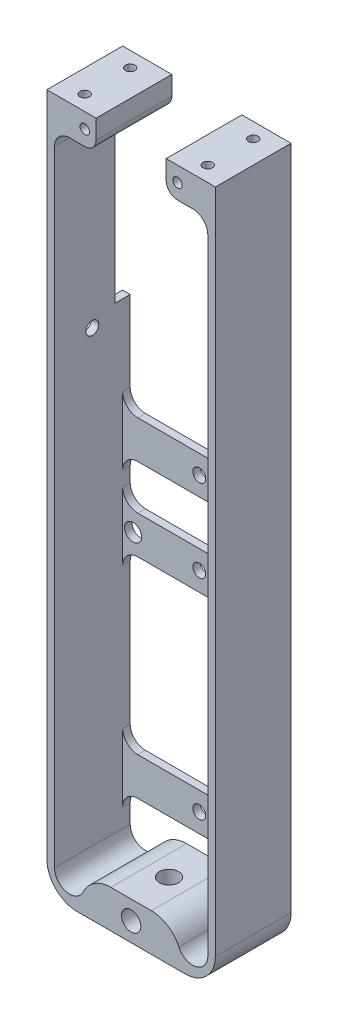
from build123d import *

# Parameters (mm, degrees)
SKETCH_1_W                = 44.5
SKETCH_1_H                = 182
EXTRUDE_1_DEPTH           = 20
FILLET_1_R                = 8
HOLE_WIZARD_1_4_201_D     = 5.1054
HOLE_WIZARD_1_4_201_DEPTH = 10
EXTRUDE_2_DEPTH           = 20
FILLET_2_R                = 100
CUT_EXTRUDE_1_REACH       = 183.194
CUT_EXTRUDE_2_REACH       = 183.636
SKETCH_7_R                = 5.25
EXTRUDE_3_DEPTH           = 20
FILLET_7_R                = 4
SKETCH_10_W               = 2
SKETCH_10_H               = 14.136672327
EXTRUDE_4_DEPTH           = 20
CUT_EXTRUDE_3_REACH       = 183.636
SKETCH_11_R               = 4.1
CUT_EXTRUDE_START         = -20
SKETCH_12_W               = 51.6
SKETCH_12_H               = 5.672918443
CUT_EXTRUDE_4_DEPTH       = 20
EXTRUDE_5_DEPTH           = 20
SKETCH_14_W               = 9.175537657
SKETCH_14_H               = 83.087631714
CUT_EXTRUDE_5_DEPTH       = 182.8267939
SKETCH_15_W               = 5
SKETCH_15_H               = 5
EXTRUDE_6_DEPTH           = 20
FILLET_10_R               = 4
HOLE_WIZARD_M31_D         = 3.4
HOLE_WIZARD_M31_DEPTH     = 2
SKETCH_21_W               = 2
SKETCH_21_H               = 34.801878649
EXTRUDE_7_DEPTH           = 20
SKETCH_23_W               = 44.5
SKETCH_23_H               = 8.742230238
CUT_EXTRUDE_8_DEPTH       = 182.8267939
SKETCH_30_W               = 2
SKETCH_30_H               = 10.09
EXTRUDE_9_DEPTH           = 20
CUT_EXTRUDE_9_REACH       = 185.604
SKETCH_32_W               = 5
SKETCH_32_H               = 3
EXTRUDE_10_DEPTH          = 20
FILLET_18_R               = 4
SKETCH_33_W               = 40.5
SKETCH_33_H               = 10
EXTRUDE_11_DEPTH          = 2
FILLET_19_R               = 4
HOLE_WIZARD_M33_D         = 3.4
HOLE_WIZARD_M33_DEPTH     = 2
HOLE_WIZARD_M33_TIP       = 1.021463052
SKETCH_36_W               = 42.5
SKETCH_36_H               = 19
CUT_EXTRUDE_11_DEPTH      = 20
SKETCH_37_W               = 11
SKETCH_37_H               = 8
EXTRUDE_12_DEPTH          = 20
FILLET_21_R               = 4
FILLET_22_R               = 3
HOLE_WIZARD_1_4_202_D     = 5.1054
HOLE_WIZARD_1_4_202_DEPTH = 6
HOLE_WIZARD_1_4_202_TIP   = 1.533816902
M3X0_52_D                 = 2.5
SKETCH_51_W               = 4.072379094
SKETCH_51_H               = 46.357723245
CUT_EXTRUDE_13_DEPTH      = 4
M3X0_53_D                 = 2.5
M3X0_53_DEPTH             = 8.5
M3X0_53_TIP               = 0.751075774
CUT_EXTRUDE_14_REACH      = 185.129
SKETCH_54_R               = 2.25
M3X0_54_D                 = 2.5
M3X0_54_DEPTH             = 8.5
M3X0_54_TIP               = 0.751075774


with BuildPart() as part:
    # Эскиз1 → Бобышка-Вытянуть1 (new body)
    with BuildSketch(Plane.XY):
        with Locations((20.25, 84)):
            Rectangle(SKETCH_1_W, SKETCH_1_H)
        with BuildLine():
            Line((8, 3), (32.5, 3))
            Line((32.5, 3), (32.5, 0))
            ThreePointArc((32.5, 0), (36.5, -4), (40.5, 0))
            Line((40.5, 0), (40.5, 173))
            Line((40.5, 173), (0, 173))
            Line((0, 173), (0, 0))
            ThreePointArc((0, 0), (4, -4), (8, 0))
            Line((8, 0), (8, 3))
        make_face(mode=Mode.SUBTRACT)
    extrude(amount=EXTRUDE_1_DEPTH)

    # Скругление1
    fillet_1_edges = [part.edges().sort_by_distance(p)[0] for p in [
        (42.5, -7, 10),
        (-2, -7, 10),
        (32.5, 3, 10),
        (8, 3, 10),
    ]]
    fillet(fillet_1_edges, radius=FILLET_1_R)

    # Отверстие обработанное метчиком 1/4-201
    with Locations(Plane(origin=(0, -7, 0), x_dir=(-1, 0, 0), z_dir=(0, -1, 0))):
        with Locations((-20.25, -10)):
            Hole(HOLE_WIZARD_1_4_201_D / 2, depth=HOLE_WIZARD_1_4_201_DEPTH)

    # Эскиз5 → Бобышка-Вытянуть2 (add)
    with BuildSketch(Plane.XY.offset(20)):
        with BuildLine():
            Line((-7.1, 158), (-7.1, 139))
            ThreePointArc((-7.1, 139), (-5.807601094, 127.936546651), (-2, 117.468859761))
            Line((-2, 117.468859761), (-2, 113.317515696))
            ThreePointArc((-2, 113.317515696), (-7.29232304, 125.677087406), (-9.1, 139))
            Line((-9.1, 139), (-9.1, 158))
            Line((-9.1, 158), (-7.1, 158))
        make_face()
    extrude(amount=-EXTRUDE_2_DEPTH)

    # Скругление2
    fillet_2_edges = [part.edges().sort_by_distance(p)[0] for p in [
        (-2, 113.317515696, 10),
    ]]
    fillet(fillet_2_edges, radius=FILLET_2_R)

    # Эскиз6 → Вырез-Вытянуть1 (cut, up to next)
    with BuildSketch(Plane.XY.offset(20), mode=Mode.PRIVATE) as cut_extrude_1_sk1:
        Polygon((0, 173), (0, 117.468859761), (-2, 117.468859761), (-2, 170), (-2, 175), (42.5, 175), (42.5, 173), align=None)
    cut_extrude_1_tool1 = extrude(cut_extrude_1_sk1.sketch, amount=-CUT_EXTRUDE_1_REACH, mode=Mode.PRIVATE) & part.part
    add(cut_extrude_1_tool1.solids().sort_by_distance((-0.72733, 145.23443, 20))[0], mode=Mode.SUBTRACT)

    # Эскиз7 → Вырез-Вытянуть2 (cut, up to next)
    with BuildSketch(Plane.ZY.offset(9.1), mode=Mode.PRIVATE) as cut_extrude_2_sk1:
        with Locations((10, 145.426275666)):
            Circle(SKETCH_7_R)
    cut_extrude_2_tool1 = extrude(cut_extrude_2_sk1.sketch, amount=-CUT_EXTRUDE_2_REACH, mode=Mode.PRIVATE) & part.part
    add(cut_extrude_2_tool1.solids().sort_by_distance((-9.1, 145.426276, 10))[0], mode=Mode.SUBTRACT)

    # Эскиз9 → Бобышка-Вытянуть3 (add)
    with BuildSketch(Plane.XY.offset(20)):
        with BuildLine():
            Line((-6.823277546, 133.853274797), (0, 133.853274797))
            Line((0, 133.853274797), (0, 117.468859761))
            Line((0, 117.468859761), (-2, 117.468859761))
            ThreePointArc((-2, 117.468859761), (-5.146247103, 125.444811779), (-6.823277546, 133.853274797))
        make_face()
    extrude(amount=-EXTRUDE_3_DEPTH)

    # Скругление7
    fillet_7_edges = [part.edges().sort_by_distance(p)[0] for p in [
        (-6.823277546, 133.853274797, 10),
    ]]
    fillet(fillet_7_edges, radius=FILLET_7_R)

    # Эскиз10 → Бобышка-Вытянуть4 (add)
    with BuildSketch(Plane.XY.offset(20)):
        with Locations((-8.1, 165.068336164)):
            Rectangle(SKETCH_10_W, SKETCH_10_H)
    extrude(amount=-EXTRUDE_4_DEPTH)

    # Эскиз11 → Вырез-Вытянуть3 (cut, up to next)
    with BuildSketch(Plane.ZY.offset(9.1), mode=Mode.PRIVATE) as cut_extrude_3_sk1:
        with Locations((10, 162.426275666)):
            Circle(SKETCH_11_R)
    cut_extrude_3_tool1 = extrude(cut_extrude_3_sk1.sketch, amount=-CUT_EXTRUDE_3_REACH, mode=Mode.PRIVATE) & part.part
    add(cut_extrude_3_tool1.solids().sort_by_distance((-9.1, 162.426276, 10))[0], mode=Mode.SUBTRACT)

    # Эскиз12 → Вырез-Вытянуть4 (cut)
    with BuildSketch(Plane.XY.offset(20).offset(CUT_EXTRUDE_START)):
        with Locations((16.7, 172.491612668)):
            Rectangle(SKETCH_12_W, SKETCH_12_H)
    extrude(amount=CUT_EXTRUDE_4_DEPTH, mode=Mode.SUBTRACT)

    # Эскиз13 → Бобышка-Вытянуть5 (add)
    with BuildSketch(Plane.XY.offset(20)):
        with BuildLine():
            Line((36.5, 175.655153446), (-3.1, 175.655153446))
            ThreePointArc((-3.1, 175.655153446), (-7.342640687, 173.897794133), (-9.1, 169.655153446))
            Line((-9.1, 169.655153446), (-7.1, 169.655153446))
            ThreePointArc((-7.1, 169.655153446), (-5.928427125, 172.483580571), (-3.1, 173.655153446))
            Line((-3.1, 173.655153446), (36.5, 173.655153446))
            ThreePointArc((36.5, 173.655153446), (39.328427125, 172.483580571), (40.5, 169.655153446))
            Line((40.5, 169.655153446), (42.5, 169.655153446))
            ThreePointArc((42.5, 169.655153446), (40.742640687, 173.897794133), (36.5, 175.655153446))
        make_face()
    extrude(amount=-EXTRUDE_5_DEPTH)

    # Эскиз14 → Вырез-Вытянуть5 (cut, through all)
    with BuildSketch(Plane.XY.offset(20)):
        with Locations((-6.587768829, 134.941293997)):
            Rectangle(SKETCH_14_W, SKETCH_14_H)
    extrude(amount=-CUT_EXTRUDE_5_DEPTH, mode=Mode.SUBTRACT)

    # Эскиз15 → Бобышка-Вытянуть6 (add)
    with BuildSketch(Plane.XY.offset(20)):
        with Locations((0.5, 171.155153446)):
            Rectangle(SKETCH_15_W, SKETCH_15_H)
    extrude(amount=-EXTRUDE_6_DEPTH)

    # Скругление10
    fillet_10_edges = [part.edges().sort_by_distance(p)[0] for p in [
        (3, 173.655153446, 10),
    ]]
    fillet(fillet_10_edges, radius=FILLET_10_R)

    # Отверстие с зазором M31
    with Locations(Plane(origin=(0, -2.517488078, -0.880886236), x_dir=(0, 0, 1), z_dir=(1, 0, 0))):
        with Locations((10.880886236, -121.020411286)):
            Hole(HOLE_WIZARD_M31_D / 2, depth=HOLE_WIZARD_M31_DEPTH)

    # Эскиз21 → Бобышка-Вытянуть7 (add)
    with BuildSketch(Plane.XY.offset(20)):
        with Locations((-1, 151.254214122)):
            Rectangle(SKETCH_21_W, SKETCH_21_H)
    extrude(amount=-EXTRUDE_7_DEPTH)

    # Эскиз23 → Вырез-Вытянуть8 (cut, through all)
    with BuildSketch(Plane.XY.offset(20)):
        with Locations((20.25, 171.284038327)):
            Rectangle(SKETCH_23_W, SKETCH_23_H)
    extrude(amount=-CUT_EXTRUDE_8_DEPTH, mode=Mode.SUBTRACT)

    # Эскиз30 → Бобышка-Вытянуть9 (add)
    with BuildSketch(Plane.XY.offset(20)):
        with Locations((41.5, 171.957923208)):
            Rectangle(SKETCH_30_W, SKETCH_30_H)
        with Locations((-1, 171.957923208)):
            Rectangle(SKETCH_30_W, SKETCH_30_H)
    extrude(amount=-EXTRUDE_9_DEPTH)

    # Эскиз27 → Вырез-Вытянуть9 (cut, up to next)
    with BuildSketch(Plane(origin=(42.5, 0, 0), x_dir=(0, 0, -1), z_dir=(1, 0, 0)), mode=Mode.PRIVATE) as cut_extrude_9_sk1:
        with BuildLine():
            Line((-11.7, 166.702923208), (-8.3, 166.702923208))
            ThreePointArc((-8.3, 166.702923208), (-4.6, 163.002923208), (-8.3, 159.302923208))
            Line((-8.3, 159.302923208), (-11.7, 159.302923208))
            ThreePointArc((-11.7, 159.302923208), (-15.4, 163.002923208), (-11.7, 166.702923208))
        make_face()
    cut_extrude_9_tool1 = extrude(cut_extrude_9_sk1.sketch, amount=-CUT_EXTRUDE_9_REACH, mode=Mode.PRIVATE) & part.part
    add(cut_extrude_9_tool1.solids().sort_by_distance((42.5, 163.002923, 10))[0], mode=Mode.SUBTRACT)

    # Эскиз32 → Бобышка-Вытянуть10 (add)
    with BuildSketch(Plane.XY.offset(20)):
        with Locations((2.5, 175.502923208)):
            Rectangle(SKETCH_32_W, SKETCH_32_H)
        with Locations((38, 175.502923208)):
            Rectangle(SKETCH_32_W, SKETCH_32_H)
    extrude(amount=-EXTRUDE_10_DEPTH)

    # Скругление18
    fillet_18_edges = [part.edges().sort_by_distance(p)[0] for p in [
        (0, 174.002923208, 10),
        (40.5, 174.002923208, 10),
    ]]
    fillet(fillet_18_edges, radius=FILLET_18_R)

    # Эскиз33 → Бобышка-Вытянуть11 (add)
    with BuildSketch(Plane(origin=(0, 0, 0), x_dir=(-1, 0, 0), z_dir=(0, 0, -1))):
        with Locations((-20.25, 13.905438329)):
            Rectangle(SKETCH_33_W, SKETCH_33_H)
        with Locations((-20.25, 90.961314987)):
            Rectangle(SKETCH_33_W, SKETCH_33_H)
        with Locations((-20.25, 69.150438329)):
            Rectangle(SKETCH_33_W, SKETCH_33_H)
    extrude(amount=-EXTRUDE_11_DEPTH)

    # Скругление19
    fillet_19_edges = [part.edges().sort_by_distance(p)[0] for p in [
        (40.5, 85.961314987, 1),
        (40.5, 95.961314987, 1),
        (0, 95.961314987, 1),
        (0, 85.961314987, 1),
        (40.5, 64.150438329, 1),
        (40.5, 74.150438329, 1),
        (0, 74.150438329, 1),
        (0, 64.150438329, 1),
        (40.5, 8.905438329, 1),
        (40.5, 18.905438329, 1),
        (0, 18.905438329, 1),
        (0, 8.905438329, 1),
    ]]
    fillet(fillet_19_edges, radius=FILLET_19_R)

    # Отверстие с зазором M33
    with Locations(Plane(origin=(0, 0, 0), x_dir=(-1, 0, 0), z_dir=(0, 0, -1))):
        with Locations((-20.25, 13.905438329), (-20.25, 69.150438329), (-20.25, 90.961314987)):
            Hole(HOLE_WIZARD_M33_D / 2, depth=HOLE_WIZARD_M33_DEPTH)
            with Locations((0, 0, -(HOLE_WIZARD_M33_DEPTH + HOLE_WIZARD_M33_TIP / 2))):  # 118° drill point
                Cone(0, HOLE_WIZARD_M33_D / 2, HOLE_WIZARD_M33_TIP, mode=Mode.SUBTRACT)

    # Эскиз36 → Вырез-Вытянуть11 (cut)
    with BuildSketch(Plane.XY.offset(20)):
        with Locations((21.25, 167.502923208)):
            Rectangle(SKETCH_36_W, SKETCH_36_H)
    extrude(amount=-CUT_EXTRUDE_11_DEPTH, mode=Mode.SUBTRACT)

    # Эскиз37 → Бобышка-Вытянуть12 (add)
    with BuildSketch(Plane.XY.offset(20)):
        Polygon((42.5, 158.002923208), (40.5, 158.002923208), (40.5, 169.002923208), (29.5, 169.002923208), (29.5, 177.002923208), (42.5, 177.002923208), align=None)
        with Locations((5.5, 173.002923208)):
            Rectangle(SKETCH_37_W, SKETCH_37_H)
    extrude(amount=-EXTRUDE_12_DEPTH)

    # Скругление21
    fillet_21_edges = [part.edges().sort_by_distance(p)[0] for p in [
        (40.5, 169.002923208, 10),
        (0, 169.002923208, 10),
    ]]
    fillet(fillet_21_edges, radius=FILLET_21_R)

    # Скругление22
    fillet_22_edges = [part.edges().sort_by_distance(p)[0] for p in [
        (29.5, 169.002923208, 10),
        (11, 169.002923208, 10),
    ]]
    fillet(fillet_22_edges, radius=FILLET_22_R)

    # Отверстие обработанное метчиком 1/4-202
    with Locations(Plane.XY.offset(20)):
        with Locations((20.25, -2)):
            Hole(HOLE_WIZARD_1_4_202_D / 2, depth=HOLE_WIZARD_1_4_202_DEPTH)
            with Locations((0, 0, -(HOLE_WIZARD_1_4_202_DEPTH + HOLE_WIZARD_1_4_202_TIP / 2))):  # 118° drill point
                Cone(0, HOLE_WIZARD_1_4_202_D / 2, HOLE_WIZARD_1_4_202_TIP, mode=Mode.SUBTRACT)

    # Отверстие обработанное метчиком M3x0.52 (through all)
    with Locations(Plane.XY.offset(20)):
        with Locations((8, 173.002923208), (32.5, 173.002923208)):
            Hole(M3X0_52_D / 2)

    # Эскиз51 → Вырез-Вытянуть13 (cut)
    with BuildSketch(Plane(origin=(0, 0, 0), x_dir=(-1, 0, 0), z_dir=(0, 0, -1))):
        with Locations((-0.036189547, 144.349578988)):
            Rectangle(SKETCH_51_W, SKETCH_51_H)
    extrude(amount=-CUT_EXTRUDE_13_DEPTH, mode=Mode.SUBTRACT)

    # Отверстие обработанное метчиком M3x0.53
    with Locations(Plane.ZY.offset(2)):
        with Locations((10, 169.502923208)):
            Hole(M3X0_53_D / 2, depth=M3X0_53_DEPTH)
            with Locations((0, 0, -(M3X0_53_DEPTH + M3X0_53_TIP / 2))):  # 118° drill point
                Cone(0, M3X0_53_D / 2, M3X0_53_TIP, mode=Mode.SUBTRACT)

    # Эскиз54 → Вырез-Вытянуть14 (cut, up to next)
    with BuildSketch(Plane(origin=(0, 0, 0), x_dir=(-1, 0, 0), z_dir=(0, 0, -1)), mode=Mode.PRIVATE) as cut_extrude_14_sk1:
        with Locations((-37.7506, 13.905438329)):
            Circle(SKETCH_54_R)
    cut_extrude_14_tool1 = extrude(cut_extrude_14_sk1.sketch, amount=-CUT_EXTRUDE_14_REACH, mode=Mode.PRIVATE) & part.part
    # Эскиз54 → Вырез-Вытянуть14 (cut, up to next)
    with BuildSketch(Plane(origin=(0, 0, 0), x_dir=(-1, 0, 0), z_dir=(0, 0, -1)), mode=Mode.PRIVATE) as cut_extrude_14_sk2:
        with Locations((-2.7494, 69.150438329)):
            Circle(SKETCH_54_R)
    cut_extrude_14_tool2 = extrude(cut_extrude_14_sk2.sketch, amount=-CUT_EXTRUDE_14_REACH, mode=Mode.PRIVATE) & part.part
    # Эскиз54 → Вырез-Вытянуть14 (cut, up to next)
    with BuildSketch(Plane(origin=(0, 0, 0), x_dir=(-1, 0, 0), z_dir=(0, 0, -1)), mode=Mode.PRIVATE) as cut_extrude_14_sk3:
        with Locations((-37.7506, 90.961314987)):
            Circle(SKETCH_54_R)
    cut_extrude_14_tool3 = extrude(cut_extrude_14_sk3.sketch, amount=-CUT_EXTRUDE_14_REACH, mode=Mode.PRIVATE) & part.part
    add(cut_extrude_14_tool1.solids().sort_by_distance((37.7506, 13.905438, 0))[0], mode=Mode.SUBTRACT)
    add(cut_extrude_14_tool2.solids().sort_by_distance((2.7494, 69.150438, 0))[0], mode=Mode.SUBTRACT)
    add(cut_extrude_14_tool3.solids().sort_by_distance((37.7506, 90.961315, 0))[0], mode=Mode.SUBTRACT)

    # Отверстие обработанное метчиком M3x0.54
    with Locations(Plane(origin=(0, 177.002923208, 0), x_dir=(1, 0, 0), z_dir=(0, 1, 0))):
        with Locations((4, -4), (4, -16), (36.5, -4), (36.5, -16)):
            Hole(M3X0_54_D / 2, depth=M3X0_54_DEPTH)
            with Locations((0, 0, -(M3X0_54_DEPTH + M3X0_54_TIP / 2))):  # 118° drill point
                Cone(0, M3X0_54_D / 2, M3X0_54_TIP, mode=Mode.SUBTRACT)


solid = part.part
